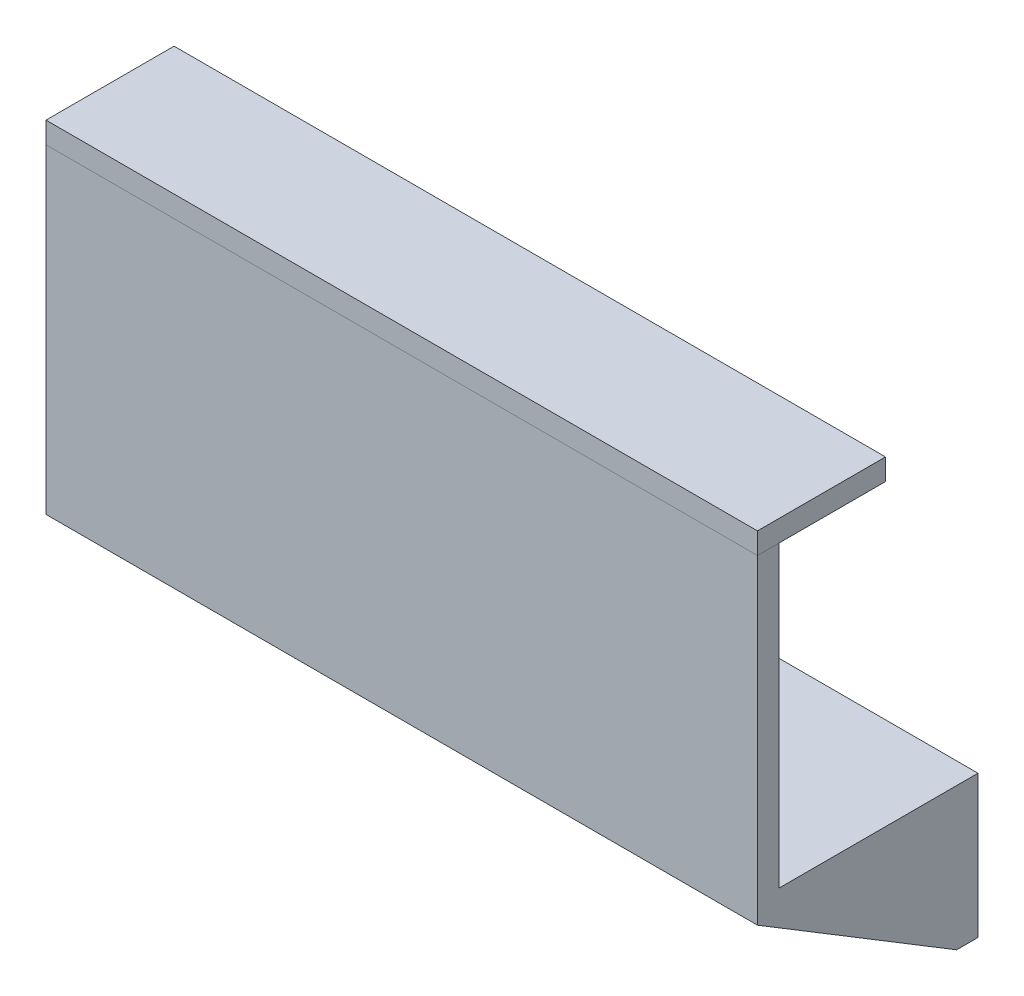
from build123d import *

# Parameters (mm, degrees)
SKETCH_1_W           = 100
SKETCH_1_H           = 20
EXTRUDE_1_DEPTH      = 3
SKETCH_2_W           = 100
SKETCH_2_H           = 3
EXTRUDE_2_DEPTH      = 25
SKETCH_3_W           = 100
SKETCH_3_H           = 45
EXTRUDE_3_DEPTH      = 3
EXTRUDE_4_DEPTH      = 15
EXTRUDE_4_DEPTH_BACK = 3
SKETCH_4_W           = 100
SKETCH_4_H           = 3
SKETCH_5_R           = 1.5
CUT_EXTRUDE_1_DEPTH  = 15
CHAMFER_1_SIZE       = 0.5
EXTRUDE_5_DEPTH      = 2
EXTRUDE_6_DEPTH      = 2


with BuildPart() as part:
    # 草图1 → 凸台-拉伸1 (new body)
    with BuildSketch(Plane.XY):
        with Locations((50, -10)):
            Rectangle(SKETCH_1_W, SKETCH_1_H)
    extrude(amount=EXTRUDE_1_DEPTH)

    # 草图2 → 凸台-拉伸2 (add)
    with BuildSketch(Plane.XY.offset(3)):
        with Locations((50, -1.5)):
            Rectangle(SKETCH_2_W, SKETCH_2_H)
    extrude(amount=EXTRUDE_2_DEPTH)

    # 草图3 → 凸台-拉伸3 (add)
    with BuildSketch(Plane.XY.offset(28)):
        with Locations((50, 19.5)):
            Rectangle(SKETCH_3_W, SKETCH_3_H)
    extrude(amount=EXTRUDE_3_DEPTH)

    # 草图5 → 切除-拉伸1 (cut)
    with BuildSketch(Plane.XY.offset(3)):
        with Locations((10, -6)):
            Circle(SKETCH_5_R)
        with Locations((89, -6)):
            Circle(SKETCH_5_R)
    extrude(amount=-CUT_EXTRUDE_1_DEPTH, mode=Mode.SUBTRACT)

    # 倒角1
    chamfer_1_edges = [part.edges().sort_by_distance(p)[0] for p in [
        (8.5, -6, 3),
        (87.5, -6, 3),
    ]]
    chamfer(chamfer_1_edges, length=CHAMFER_1_SIZE)

    # 草图7 → 凸台-拉伸6 (add)
    with BuildSketch(Plane(origin=(100, 0, 0), x_dir=(0, 0, -1), z_dir=(1, 0, 0))):
        Polygon((-3, -20), (-3, -3), (-31, -3), align=None)
    extrude(amount=-EXTRUDE_6_DEPTH)


with BuildPart() as body_2:
    # 草图4 → 凸台-拉伸4 (new, two sides: drawn at the far end of the back side and taken through both)
    with BuildSketch(Plane(origin=(0, 0, 28), x_dir=(-1, 0, 0), z_dir=(0, 0, -1)).offset(-EXTRUDE_4_DEPTH_BACK)):
        with Locations((-50, 43.5)):
            Rectangle(SKETCH_4_W, SKETCH_4_H)
    extrude(amount=EXTRUDE_4_DEPTH + EXTRUDE_4_DEPTH_BACK)


with BuildPart() as body_3:
    # 草图6 → 凸台-拉伸5 (new body)
    with BuildSketch(Plane.ZY):
        Polygon((3, -20), (31, -3), (3, -3), align=None)
    extrude(amount=-EXTRUDE_5_DEPTH)


solid = Compound([part.part, body_2.part, body_3.part])
